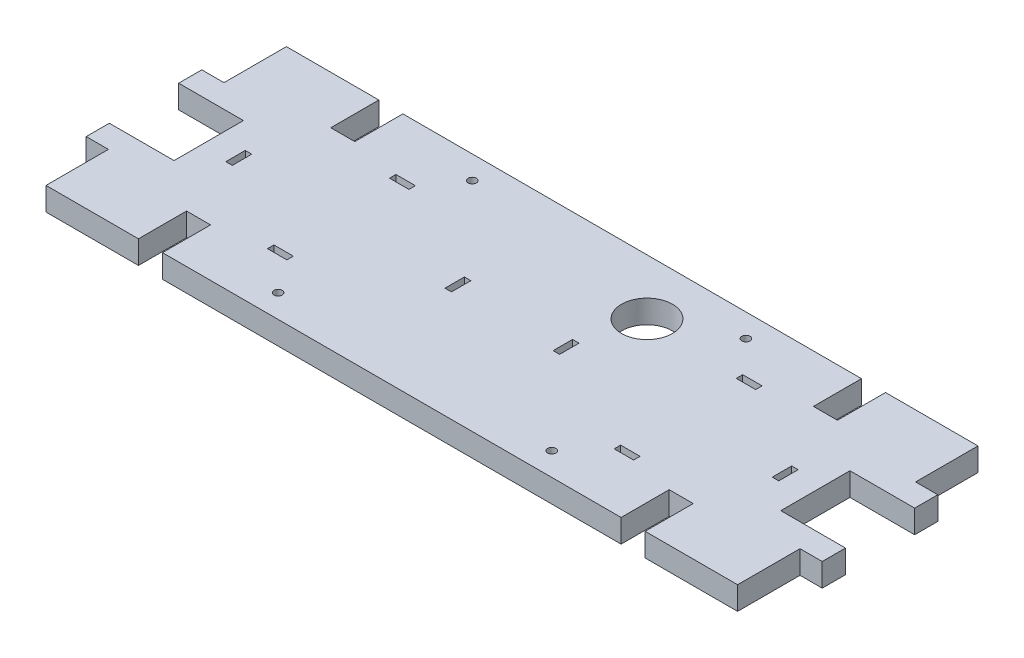
from build123d import *

# Parameters (mm, degrees)
BOSS_EXTRUDE1_DEPTH = 6.35
SKETCH2_R           = 6.985
SKETCH2_W           = 5.334
SKETCH2_H           = 1.778
CUT_EXTRUDE1_DEPTH  = 10.16
SKETCH3_W           = 1.778
SKETCH3_H           = 5.334
CUT_EXTRUDE2_DEPTH  = 10.16
SKETCH4_R           = 1.1303
CUT_EXTRUDE3_DEPTH  = 10.16
SKETCH5_W           = 17.78
SKETCH5_H           = 19.05
SKETCH5_H_2         = 18.9992
CUT_EXTRUDE4_DEPTH  = 10.16


with BuildPart() as part:
    # Sketch1 → Boss-Extrude1 (new body)
    with BuildSketch(Plane(origin=(0, 0, 0), x_dir=(1, 0, 0), z_dir=(0, 1, 0))):
        Polygon((-95.504, 15.875), (-101.6, 15.875), (-101.6, -15.875), (-95.504, -15.875), (-95.504, -33.02), (-70.104, -33.02), (-70.104, -19.812), (-63.5, -19.812), (-63.5, -33.02), (2.794, -33.02), (9.398, -33.02), (62.484, -33.02), (62.484, -19.812), (69.088, -19.812), (69.088, -33.02), (94.488, -33.02), (94.488, -15.875), (100.584, -15.875), (100.584, 15.875), (94.488, 15.875), (94.488, 33.02), (69.088, 33.02), (69.088, 19.812), (62.484, 19.812), (62.484, 33.02), (9.398, 33.02), (2.794, 33.02), (-63.5, 33.02), (-63.5, 19.812), (-70.104, 19.812), (-70.104, 33.02), (-95.504, 33.02), align=None)
    extrude(amount=BOSS_EXTRUDE1_DEPTH)

    # Sketch2 → Cut-Extrude1 (cut)
    with BuildSketch(Plane(origin=(0, 6.35, 0), x_dir=(1, 0, 0), z_dir=(0, 1, 0))):
        with Locations(Location((18.796, 17.78, 0), (0, 0, 270))):
            Circle(SKETCH2_R)
        with Locations((-47.371, 16.764)):
            Rectangle(SKETCH2_W, SKETCH2_H)
        with Locations((-47.371, -16.764)):
            Rectangle(SKETCH2_W, SKETCH2_H)
        with Locations((47.879, 16.764)):
            Rectangle(SKETCH2_W, SKETCH2_H)
        with Locations((47.879, -16.764)):
            Rectangle(SKETCH2_W, SKETCH2_H)
    extrude(amount=-CUT_EXTRUDE1_DEPTH, mode=Mode.SUBTRACT)

    # Sketch3 → Cut-Extrude2 (cut)
    with BuildSketch(Plane(origin=(0, 6.35, 0), x_dir=(1, 0, 0), z_dir=(0, 1, 0))):
        with Locations((-75.565, 0)):
            Rectangle(SKETCH3_W, SKETCH3_H)
        with Locations((-15.367, 0)):
            Rectangle(SKETCH3_W, SKETCH3_H)
        with Locations((14.351, 0)):
            Rectangle(SKETCH3_W, SKETCH3_H)
        with Locations((74.549, 0)):
            Rectangle(SKETCH3_W, SKETCH3_H)
    extrude(amount=-CUT_EXTRUDE2_DEPTH, mode=Mode.SUBTRACT)

    # Sketch4 → Cut-Extrude3 (cut)
    with BuildSketch(Plane(origin=(0, 6.35, 0), x_dir=(1, 0, 0), z_dir=(0, 1, 0))):
        with Locations(Location((-38.1, 26.67, 0), (0, 0, 270))):
            Circle(SKETCH4_R)
        with Locations(Location((37.084, 26.67, 0), (0, 0, 270))):
            Circle(SKETCH4_R)
        with Locations(Location((-38.1, -26.67, 0), (0, 0, 270))):
            Circle(SKETCH4_R)
        with Locations(Location((37.084, -26.67, 0), (0, 0, 270))):
            Circle(SKETCH4_R)
    extrude(amount=-CUT_EXTRUDE3_DEPTH, mode=Mode.SUBTRACT)

    # Sketch5 → Cut-Extrude4 (cut)
    with BuildSketch(Plane.XZ):
        with Locations((-92.71, 0)):
            Rectangle(SKETCH5_W, SKETCH5_H)
        with Locations((91.694, -0.0254)):
            Rectangle(SKETCH5_W, SKETCH5_H_2)
    extrude(amount=-CUT_EXTRUDE4_DEPTH, mode=Mode.SUBTRACT)


solid = part.part
